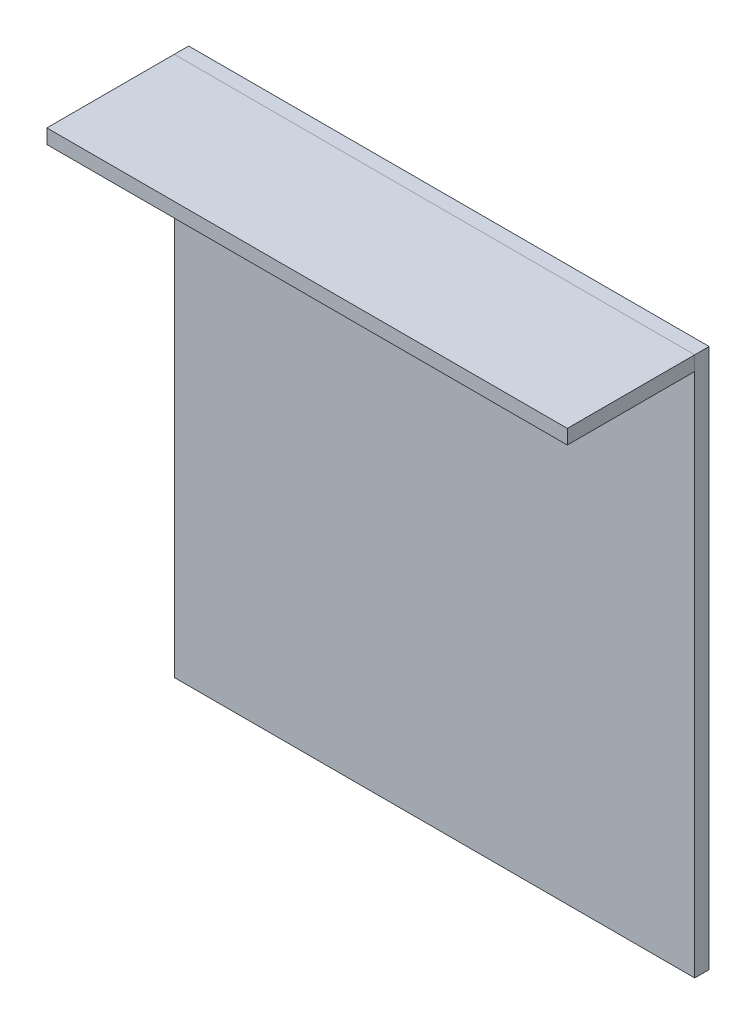
from build123d import *

# Parameters (mm, degrees)
SKETCH1_W           = 433
SKETCH1_H           = 449
BOSS_EXTRUDE1_DEPTH = 12
SKETCH2_W           = 433
SKETCH2_H           = 12
BOSS_EXTRUDE2_DEPTH = 106
SKETCH3_R           = 2.5
CUT_EXTRUDE1_DEPTH  = 6


with BuildPart() as part:
    # Sketch1 → Boss-Extrude1 (new body)
    with BuildSketch(Plane.XY):
        with Locations((0, -5.5)):
            Rectangle(SKETCH1_W, SKETCH1_H)
    extrude(amount=BOSS_EXTRUDE1_DEPTH)

    # Sketch3 → Cut-Extrude1 (cut)
    with BuildSketch(Plane(origin=(0, 0, 0), x_dir=(-1, 0, 0), z_dir=(0, 0, -1))):
        with Locations((210.5, -161)):
            Circle(SKETCH3_R)
        with Locations((210.5, -129)):
            Circle(SKETCH3_R)
        with Locations((-158.488226886, -129)):
            Circle(SKETCH3_R)
        with Locations((-158.488226886, -161)):
            Circle(SKETCH3_R)
    extrude(amount=-CUT_EXTRUDE1_DEPTH, mode=Mode.SUBTRACT)


with BuildPart() as body_2:
    # Sketch2 → Boss-Extrude2 (new body)
    with BuildSketch(Plane.XY.offset(12)):
        with Locations((0, 213)):
            Rectangle(SKETCH2_W, SKETCH2_H)
    extrude(amount=BOSS_EXTRUDE2_DEPTH)


solid = Compound([part.part, body_2.part])
